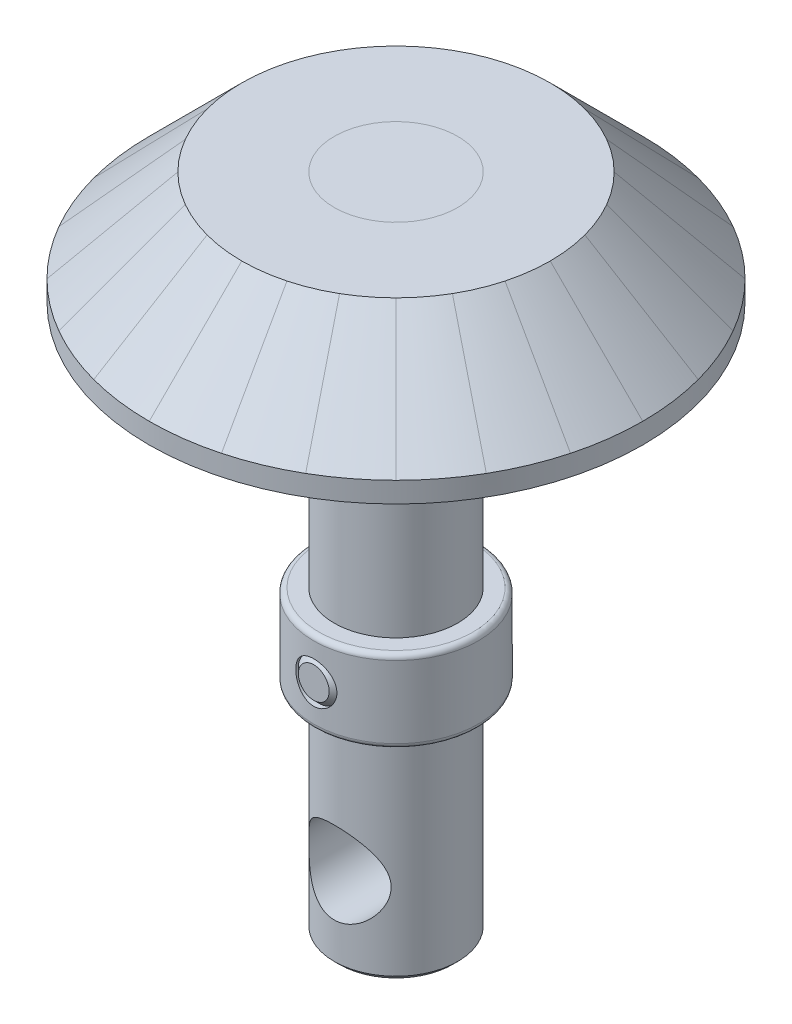
from build123d import *

# Parameters (mm, degrees)
SKETCH2_R               = 3
BOSS_EXTRUDE1_DEPTH     = 32
SKETCH4_W               = 1
SKETCH4_H               = 4
SKETCH3_3_R             = 1
BOSS_EXTRUDE2_DEPTH     = 5.25
SKETCH3_4_R             = 1
BOSS_EXTRUDE3_DEPTH     = 4
CUT_EXTRUDE1_DEPTH      = 33.67357495
CUT_EXTRUDE1_DEPTH_BACK = 33.67357495
SKETCH3_R               = 2
SKETCH3_R_2             = 1
CUT_EXTRUDE2_DEPTH      = 37.221540641
CUT_EXTRUDE2_DEPTH_BACK = 37.221540641
SKETCH3_5_R             = 2
SKETCH3_5_R_2           = 1
SKETCH3_7_R             = 1
BOSS_EXTRUDE5_DEPTH     = 4
FILLET1_R               = 0.25
CHAMFER1_SIZE           = 0.25
CHAMFER2_SIZE           = 0.25
CHAMFER3_SIZE           = 0.25


with BuildPart() as part:
    # Sketch2 → Boss-Extrude1 (new body)
    with BuildSketch(Plane(origin=(0, 0, 0), x_dir=(1, 0, 0), z_dir=(0, 1, 0))):
        Circle(SKETCH2_R)
    extrude(amount=BOSS_EXTRUDE1_DEPTH)


with BuildPart() as body_2:
    # Sketch4 → Revolve1 (revolve)
    with BuildSketch(Plane(origin=(0, 0, 0), x_dir=(0, 0, -1), z_dir=(1, 0, 0))):
        with Locations((3.5, 12.5)):
            Rectangle(SKETCH4_W, SKETCH4_H)
    revolve(axis=Axis((0, 32, 0), (0, -1, 0)))


with BuildPart() as body_3:
    # Sketch3<3> → Boss-Extrude2 (new, symmetric)
    with BuildSketch(Plane.XY):
        with Locations((0, 25)):
            Circle(SKETCH3_3_R)
    extrude(amount=BOSS_EXTRUDE2_DEPTH, both=True)

    # Chamfer2
    chamfer2_edges = [body_3.edges().sort_by_distance(p)[0] for p in [
        (-1, 25, 5.25),
        (-1, 25, -5.25),
    ]]
    chamfer(chamfer2_edges, length=CHAMFER2_SIZE)


with BuildPart() as body_4:
    # Sketch3<4> → Boss-Extrude3 (new, symmetric)
    with BuildSketch(Plane.XY):
        with Locations((0, 12.5)):
            Circle(SKETCH3_4_R)
    extrude(amount=BOSS_EXTRUDE3_DEPTH, both=True)


with BuildPart() as cut_extrude1_tool:
    # Sketch3 → Cut-Extrude1 (new, two sides: drawn at the far end of the back side and taken through both)
    with BuildSketch(Plane.XY.offset(-CUT_EXTRUDE1_DEPTH_BACK)):
        with Locations((0, 4)):
            Circle(SKETCH3_R)
        with Locations((0, 12.5)):
            Circle(SKETCH3_R_2)
        with Locations((0, 25)):
            Circle(SKETCH3_R_2)
    extrude(amount=CUT_EXTRUDE1_DEPTH + CUT_EXTRUDE1_DEPTH_BACK)


with BuildPart() as part_1:
    add(part.part)

    # Cut-Extrude1: cut by cut_extrude1_tool
    add(cut_extrude1_tool.part, mode=Mode.SUBTRACT)

    # Chamfer3
    chamfer3_edges = [part_1.edges().sort_by_distance(p)[0] for p in [
        (-3, 0, 0),
    ]]
    chamfer(chamfer3_edges, length=CHAMFER3_SIZE)


with BuildPart() as body_2_1:
    add(body_2.part)

    # Cut-Extrude1: cut by cut_extrude1_tool
    add(cut_extrude1_tool.part, mode=Mode.SUBTRACT)

    # Fillet1
    fillet1_edges = [body_2_1.edges().sort_by_distance(p)[0] for p in [
        (0, 10.5, 4),
        (0, 14.5, 4),
    ]]
    fillet(fillet1_edges, radius=FILLET1_R)


with BuildPart() as body_5:
    # Sketch8 → Revolve5 (revolve)
    with BuildSketch(Plane.XY):
        Polygon((-3, 23.5), (-3, 32), (-7.5, 32), (-12, 27.5), (-12, 26.5), (-5, 26.5), (-5, 23.5), align=None)
    revolve(axis=Axis((0, 32, 0), (0, -1, 0)))


with BuildPart() as cut_extrude2_tool:
    # Sketch3<5> → Cut-Extrude2 (new, two sides: drawn at the far end of the back side and taken through both)
    with BuildSketch(Plane.XY.offset(-CUT_EXTRUDE2_DEPTH_BACK)):
        with Locations((0, 4)):
            Circle(SKETCH3_5_R)
        with Locations((0, 12.5)):
            Circle(SKETCH3_5_R_2)
        with Locations((0, 25)):
            Circle(SKETCH3_5_R_2)
    extrude(amount=CUT_EXTRUDE2_DEPTH + CUT_EXTRUDE2_DEPTH_BACK)


with BuildPart() as body_4_1:
    add(body_4.part)

    # Cut-Extrude2: cut by cut_extrude2_tool
    add(cut_extrude2_tool.part, mode=Mode.SUBTRACT)


with BuildPart() as body_5_1:
    add(body_5.part)

    # Cut-Extrude2: cut by cut_extrude2_tool
    add(cut_extrude2_tool.part, mode=Mode.SUBTRACT)


with BuildPart() as body_5_2:
    # Sketch3<7> → Boss-Extrude5 (new, symmetric)
    with BuildSketch(Plane.XY):
        with Locations((0, 12.5)):
            Circle(SKETCH3_7_R)
    extrude(amount=BOSS_EXTRUDE5_DEPTH, both=True)

    # Chamfer1
    chamfer1_edges = [body_5_2.edges().sort_by_distance(p)[0] for p in [
        (-1, 12.5, -4),
        (-1, 12.5, 4),
    ]]
    chamfer(chamfer1_edges, length=CHAMFER1_SIZE)


solid = Compound([body_3.part, part_1.part, body_2_1.part, body_5_1.part, body_5_2.part])
